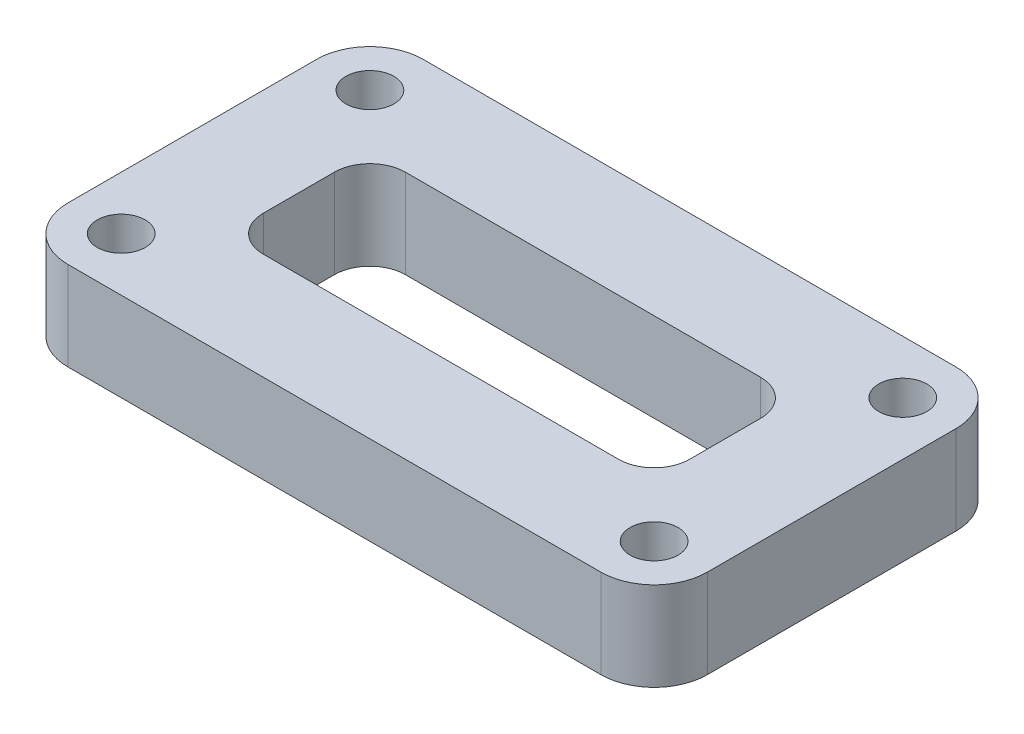
from build123d import *

# Parameters (mm, degrees)
SKETCH_1_W      = 36
SKETCH_1_H      = 20
SKETCH_1_R      = 1.35
SKETCH_1_W_2    = 24
SKETCH_1_H_2    = 8
EXTRUDE_1_DEPTH = 5
FILLET_1_R      = 3
FILLET_2_R      = 2


with BuildPart() as part:
    # 草图1 → 凸台-拉伸1 (new body)
    with BuildSketch(Plane(origin=(0, 0, 0), x_dir=(1, 0, 0), z_dir=(0, 1, 0))):
        with Locations((18, 10)):
            Rectangle(SKETCH_1_W, SKETCH_1_H)
        with Locations(Location((3, 17, 0), (0, 0, 270))):
            Circle(SKETCH_1_R, mode=Mode.SUBTRACT)
        with Locations(Location((33, 17, 0), (0, 0, 90))):
            Circle(SKETCH_1_R, mode=Mode.SUBTRACT)
        with Locations(Location((33, 3, 0), (0, 0, 270))):
            Circle(SKETCH_1_R, mode=Mode.SUBTRACT)
        with Locations(Location((3, 3, 0), (0, 0, 90))):
            Circle(SKETCH_1_R, mode=Mode.SUBTRACT)
        with Locations((18, 10)):
            Rectangle(SKETCH_1_W_2, SKETCH_1_H_2, mode=Mode.SUBTRACT)
    extrude(amount=EXTRUDE_1_DEPTH)

    # 圆角1
    fillet_1_edges = [part.edges().sort_by_distance(p)[0] for p in [
        (0, 2.5, -20),
        (36, 2.5, -20),
        (36, 2.5, 0),
        (0, 2.5, 0),
    ]]
    fillet(fillet_1_edges, radius=FILLET_1_R)

    # 圆角2
    fillet_2_edges = [part.edges().sort_by_distance(p)[0] for p in [
        (6, 2.5, -6),
        (30, 2.5, -6),
        (30, 2.5, -14),
        (6, 2.5, -14),
    ]]
    fillet(fillet_2_edges, radius=FILLET_2_R)


solid = part.part
